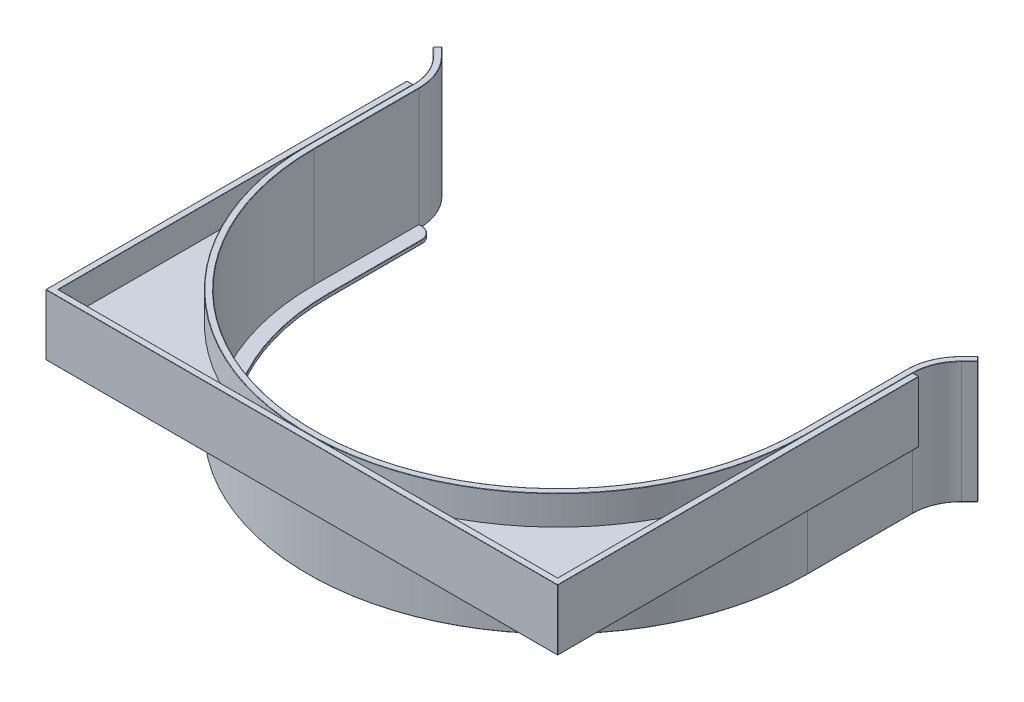
from build123d import *

# Parameters (mm, degrees)
BOSS_EXTRUDE1_DEPTH  = 100
BOSS_EXTRUDE2_DEPTH  = 100
BOSS_EXTRUDE3_DEPTH  = 3
FILLET1_R            = 10
BOSS_EXTRUDE4_DEPTH  = 50
BOSS_EXTRUDE10_DEPTH = 1
FILLET2_R            = 0.3
FILLET3_R            = 0.2


with BuildPart() as part:
    # Sketch1 → Boss-Extrude1 (new body)
    with BuildSketch(Plane(origin=(0, 0, 0), x_dir=(1, 0, 0), z_dir=(0, 1, 0))):
        with BuildLine():
            Line((205, 0), (200, 0))
            ThreePointArc((200, 0), (0, -200), (-200, 0))
            Line((-200, 0), (-205, 0))
            ThreePointArc((-205, 0), (0, -205), (205, 0))
        make_face()
    extrude(amount=BOSS_EXTRUDE1_DEPTH)

    # Sketch2 → Boss-Extrude2 (add)
    with BuildSketch(Plane(origin=(0, 0, 0), x_dir=(1, 0, 0), z_dir=(0, 1, 0))):
        with BuildLine():
            Line((-223.535533906, 121.464466094), (-216.715728753, 114.644660941))
            ThreePointArc((-216.715728753, 114.644660941), (-208.0448187, 101.667726988), (-205, 86.360389693))
            Line((-205, 86.360389693), (-205, 0))
            Line((-205, 0), (-200, 0))
            Line((-200, 0), (-200, 86.360389693))
            ThreePointArc((-200, 86.360389693), (-203.425421037, 103.58114415), (-213.180194847, 118.180194847))
            Line((-213.180194847, 118.180194847), (-220, 125))
            Line((-220, 125), (-223.535533906, 121.464466094))
        make_face()
    boss_extrude2 = extrude(amount=BOSS_EXTRUDE2_DEPTH)

    # Mirror1: Boss-Extrude2 across plane
    add(boss_extrude2.mirror(Plane(origin=(0, 0, 0), x_dir=(0, 0, 1), z_dir=(1, 0, 0))))

    # Sketch3 → Boss-Extrude3 (add)
    with BuildSketch(Plane(origin=(0, 0, 0), x_dir=(1, 0, 0), z_dir=(0, 1, 0))):
        with BuildLine():
            Line((-200, 0), (-200, 86.360389693))
            Line((-200, 86.360389693), (-188, 86.360389693))
            Line((-188, 86.360389693), (-188, 0))
            ThreePointArc((-188, 0), (0, -188), (188, 0))
            Line((188, 0), (188, 86.360389693))
            Line((188, 86.360389693), (200, 86.360389693))
            Line((200, 86.360389693), (200, 0))
            ThreePointArc((200, 0), (0, -200), (-200, 0))
        make_face()
    extrude(amount=BOSS_EXTRUDE3_DEPTH)

    # Fillet1
    fillet1_edges = [part.edges().sort_by_distance(p)[0] for p in [
        (-188, 1.5, -86.360389693),
        (188, 1.5, -86.360389693),
    ]]
    fillet(fillet1_edges, radius=FILLET1_R)

    # Fillet2
    fillet2_edges = [part.edges().sort_by_distance(p)[0] for p in [
        (-220, 50, -125),
        (-221.767766953, 0, -123.232233047),
        (-223.535533906, 50, -121.464466094),
        (-220.125631329, 0, -118.054563517),
        (-208.0448187, 0, -101.667726988),
        (-205, 0, -43.180194847),
        (-203.425421037, 0, -103.58114415),
        (0, 100, 200),
        (-216.590097423, 0, -121.590097423),
        (-216.590097423, 100, -121.590097423),
        (-221.767766953, 100, -123.232233047),
        (-220.125631329, 100, -118.054563517),
        (-208.0448187, 100, -101.667726988),
        (-205, 100, -43.180194847),
        (-200, 100, -43.180194847),
        (-203.425421037, 100, -103.58114415),
        (221.767766953, 0, -123.232233047),
        (220.125631329, 0, -118.054563517),
        (208.0448187, 0, -101.667726988),
        (205, 0, -43.180194847),
        (203.425421037, 0, -103.58114415),
        (216.590097423, 0, -121.590097423),
        (220.125631329, 100, -118.054563517),
        (208.0448187, 100, -101.667726988),
        (205, 100, -43.180194847),
        (200, 100, -43.180194847),
        (203.425421037, 100, -103.58114415),
        (216.590097423, 100, -121.590097423),
        (220, 50, -125),
        (221.767766953, 100, -123.232233047),
        (223.535533906, 50, -121.464466094),
        (199, 0, -86.360389693),
        (0, 0, 188),
        (-188, 0, -38.180194847),
        (199, 3, -86.360389693),
        (0, 3, 188),
        (-188, 3, -38.180194847),
        (0, 0, 205),
        (-199, 0, -86.360389693),
        (-199, 3, -86.360389693),
        (188, 0, -38.180194847),
        (190.928932188, 0, -83.431457505),
        (-190.928932188, 0, -83.431457505),
        (188, 3, -38.180194847),
        (190.928932188, 3, -83.431457505),
        (-190.928932188, 3, -83.431457505),
        (0, 100, 205),
    ]]
    fillet(fillet2_edges, radius=FILLET2_R)


with BuildPart() as body_2:
    # Sketch4 → Boss-Extrude4 (new body)
    with BuildSketch(Plane(origin=(0, 100, 0), x_dir=(1, 0, 0), z_dir=(0, 1, 0))):
        Polygon((-205, 86.360389693), (-205, -205), (205, -205), (205, 86.360389693), (210, 86.360389693), (210, -210), (-210, -210), (-210, 86.360389693), align=None)
    extrude(amount=-BOSS_EXTRUDE4_DEPTH)

    # Fillet3
    fillet3_edges = [body_2.edges().sort_by_distance(p)[0] for p in [
        (0, 50, 210),
        (-210, 100, 61.819805153),
        (-207.5, 100, -86.360389693),
        (210, 50, 61.819805153),
        (-205, 75, -86.360389693),
        (-205, 75, 205),
        (210, 75, -86.360389693),
        (210, 75, 210),
        (-210, 75, 210),
        (-210, 75, -86.360389693),
        (207.5, 50, -86.360389693),
        (205, 50, 59.319805153),
        (0, 50, 205),
        (-205, 50, 59.319805153),
        (-207.5, 50, -86.360389693),
        (-210, 50, 61.819805153),
        (-205, 100, 59.319805153),
        (0, 100, 205),
        (205, 100, 59.319805153),
        (207.5, 100, -86.360389693),
        (210, 100, 61.819805153),
        (0, 100, 210),
    ]]
    fillet(fillet3_edges, radius=FILLET3_R)


with BuildPart() as body_3:
    # Sketch6 → Boss-Extrude10 (new, symmetric)
    with BuildSketch(Plane(origin=(0, 75, 0), x_dir=(1, 0, 0), z_dir=(0, 1, 0))):
        with BuildLine():
            Line((-49.598387071, -205), (-205, -205))
            Line((-205, -205), (-205, -49.598387071))
            ThreePointArc((-205, -49.598387071), (-202.360288346, -46.620100263), (-199.086538462, -48.883025719))
            ThreePointArc((-199.086538462, -48.883025719), (-144.956890143, -144.956890143), (-48.883025719, -199.086538462))
            ThreePointArc((-48.883025719, -199.086538462), (-46.620100263, -202.360288346), (-49.598387071, -205))
        make_face()
    extrude(amount=BOSS_EXTRUDE10_DEPTH, both=True)


with BuildPart() as body_4:
    # Mirror3: mirrored copy
    add(body_3.part.mirror(Plane(origin=(0, 0, 0), x_dir=(0, 0, 1), z_dir=(1, 0, 0))))


solid = Compound([part.part, body_2.part, body_3.part, body_4.part])
